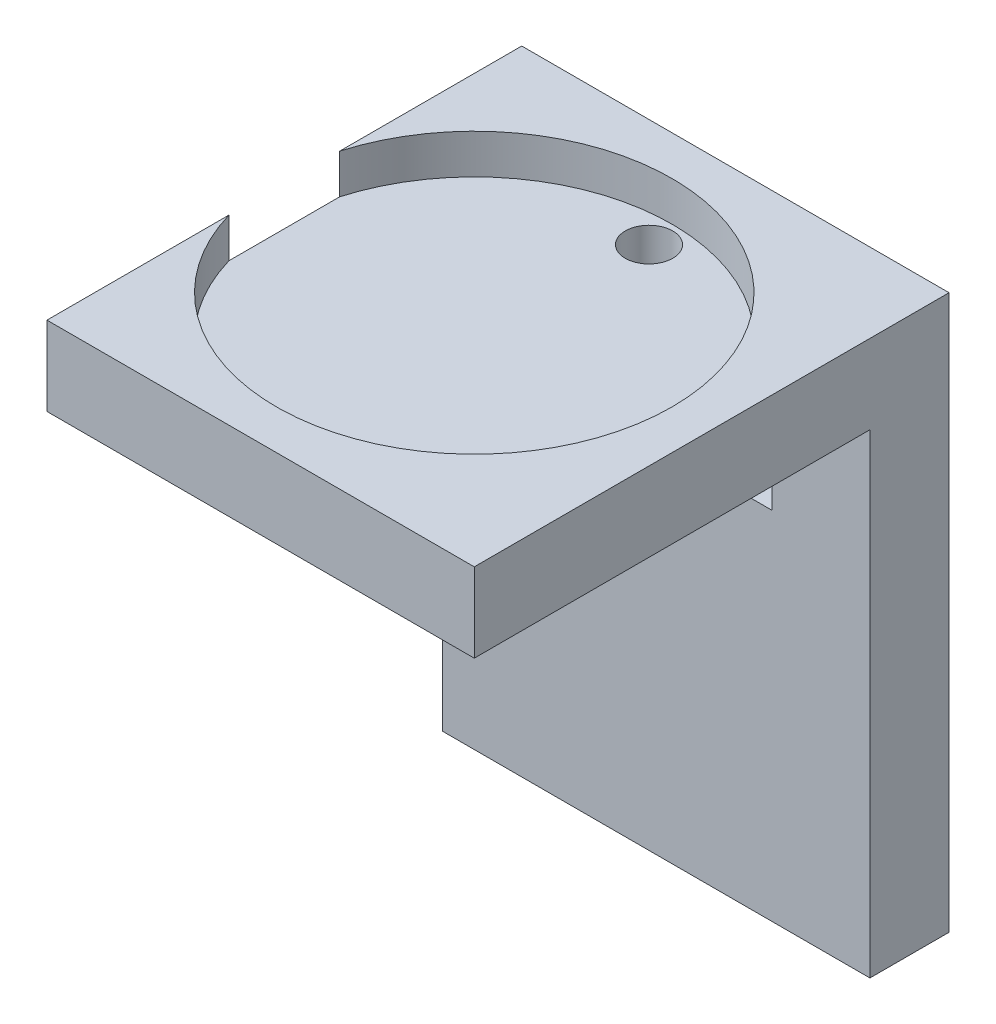
from build123d import *

# Parameters (mm, degrees)
SKETCH1_W                      = 670
SKETCH1_H                      = 120
BOSS_EXTRUDE1_DEPTH            = 530
SKETCH2_W                      = 100
SKETCH2_H                      = 200
SKETCH2_W_2                    = 650
SKETCH2_H_2                    = 250
CUT_EXTRUDE1_DEPTH             = 100
SKETCH3_R                      = 50
CUT_EXTRUDE2_DEPTH             = 260
F_12_0_12_DIAMETER_HOLE2_D     = 12
F_12_0_12_DIAMETER_HOLE2_DEPTH = 30
F_12_0_12_DIAMETER_HOLE2_TIP   = 3.605163714
SKETCH8_W                      = 650
SKETCH8_H                      = 50
BOSS_EXTRUDE2_DEPTH            = 5
SKETCH9_W                      = 10
SKETCH9_H                      = 250
CUT_EXTRUDE3_DEPTH             = 717
CUT_EXTRUDE4_DEPTH             = 5
SKETCH11_W                     = 10
SKETCH11_H                     = 100
BOSS_EXTRUDE3_DEPTH            = 78
BOSS_EXTRUDE3_2_DEPTH          = 78
BOSS_EXTRUDE3_3_DEPTH          = 78
SKETCH12_W                     = 20
SKETCH12_H                     = 30
CUT_EXTRUDE5_DEPTH             = 80
SKETCH15_W                     = 30
SKETCH15_H                     = 23.536156656
SKETCH15_H_2                   = 28.986603691
CUT_EXTRUDE7_DEPTH             = 35
SHELL1_T                       = -3
SKETCH16_W                     = 14
SKETCH16_H                     = 14
CUT_EXTRUDE8_DEPTH             = 35
SKETCH17_W                     = 5.729882812
SKETCH17_H                     = 17.428393554
SKETCH17_W_2                   = 13.369726562
SKETCH17_H_2                   = 3.342431641
BOSS_EXTRUDE4_DEPTH            = 5
CUT_EXTRUDE10_DEPTH            = 863.670273187
CUT_EXTRUDE10_DEPTH_BACK       = 863.670273187
SKETCH18_W                     = 670
SKETCH18_H                     = 250
CUT_EXTRUDE12_DEPTH            = 734.007503372
CUT_EXTRUDE12_DEPTH_BACK       = 734.007503372
SKETCH19_W                     = 440
SKETCH19_H                     = 280
SKETCH20_W                     = 210.918945895
SKETCH20_H                     = 296.400973443
CUT_EXTRUDE14_DEPTH            = 156
CUT_EXTRUDE15_DEPTH            = 376.898922584
CUT_EXTRUDE15_DEPTH_BACK       = 376.898922584
SKETCH21_W                     = 108
SKETCH21_H                     = 140


with BuildPart() as part:
    # Sketch1 → Boss-Extrude1 (new body)
    with BuildSketch(Plane(origin=(0, 0, 0), x_dir=(1, 0, 0), z_dir=(0, 1, 0))):
        with Locations((335, 60)):
            Rectangle(SKETCH1_W, SKETCH1_H)
    extrude(amount=BOSS_EXTRUDE1_DEPTH)

    # Sketch2 → Cut-Extrude1 (cut)
    with BuildSketch(Plane.XY):
        with Locations((60, 380)):
            Rectangle(SKETCH2_W, SKETCH2_H)
        with Locations((170, 380)):
            Rectangle(SKETCH2_W, SKETCH2_H)
        with Locations((280, 380)):
            Rectangle(SKETCH2_W, SKETCH2_H)
        with Locations((390, 380)):
            Rectangle(SKETCH2_W, SKETCH2_H)
        with Locations((500, 380)):
            Rectangle(SKETCH2_W, SKETCH2_H)
        with Locations((610, 380)):
            Rectangle(SKETCH2_W, SKETCH2_H)
        with Locations((335, 135)):
            Rectangle(SKETCH2_W_2, SKETCH2_H_2)
    extrude(amount=-CUT_EXTRUDE1_DEPTH, mode=Mode.SUBTRACT)

    # Sketch3 → Cut-Extrude2 (cut)
    with BuildSketch(Plane(origin=(0, 530, 0), x_dir=(1, 0, 0), z_dir=(0, 1, 0))):
        with Locations(Location((60, 60, 0), (0, 0, 270))):
            Circle(SKETCH3_R)
        with Locations(Location((170, 60, 0), (0, 0, 270))):
            Circle(SKETCH3_R)
        with Locations(Location((280, 60, 0), (0, 0, 270))):
            Circle(SKETCH3_R)
        with Locations(Location((390, 60, 0), (0, 0, 270))):
            Circle(SKETCH3_R)
        with Locations(Location((500, 60, 0), (0, 0, 270))):
            Circle(SKETCH3_R)
        with Locations(Location((610, 60, 0), (0, 0, 270))):
            Circle(SKETCH3_R)
    extrude(amount=-CUT_EXTRUDE2_DEPTH, mode=Mode.SUBTRACT)

    # Ø12.0 (12) Diameter Hole2
    with Locations(Plane(origin=(59.704642413, 270, -102.411697903), x_dir=(0, 0, 1), z_dir=(0, 1, 0))):
        with Locations((0, 0), (-0.195888006, 111.8520513), (0.014838595, 221.167624818), (-0.341843303, 331.364008353), (0.657723149, 441.008646429), (1.288998006, 549.811854685)):
            Hole(F_12_0_12_DIAMETER_HOLE2_D / 2, depth=F_12_0_12_DIAMETER_HOLE2_DEPTH)
            with Locations((0, 0, -(F_12_0_12_DIAMETER_HOLE2_DEPTH + F_12_0_12_DIAMETER_HOLE2_TIP / 2))):  # 118° drill point
                Cone(0, F_12_0_12_DIAMETER_HOLE2_D / 2, F_12_0_12_DIAMETER_HOLE2_TIP, mode=Mode.SUBTRACT)

    # Sketch8 → Boss-Extrude2 (add)
    with BuildSketch(Plane.XY):
        with Locations((335, 305)):
            Rectangle(SKETCH8_W, SKETCH8_H)
    extrude(amount=-BOSS_EXTRUDE2_DEPTH)

    # Sketch9 → Cut-Extrude3 (cut)
    with BuildSketch(Plane(origin=(670, 0, 0), x_dir=(0, 0, -1), z_dir=(1, 0, 0))):
        with Locations((15, 135)):
            Rectangle(SKETCH9_W, SKETCH9_H)
    extrude(amount=-CUT_EXTRUDE3_DEPTH, mode=Mode.SUBTRACT)

    # Sketch10 → Cut-Extrude4 (cut)
    with BuildSketch(Plane(origin=(0, 10, 0), x_dir=(1, 0, 0), z_dir=(0, 1, 0))):
        Polygon((365, 61.943560596), (350, 87.924322709), (320, 87.924322709), (305, 61.943560596), (320, 35.962798482), (350, 35.962798482), align=None)
    extrude(amount=-CUT_EXTRUDE4_DEPTH, mode=Mode.SUBTRACT)

    # Sketch12 → Cut-Extrude5 (cut)
    with BuildSketch(Plane.XY.offset(-100)):
        with Locations((85.198613037, 245)):
            Rectangle(SKETCH12_W, SKETCH12_H)
        with Locations((195.198613037, 245)):
            Rectangle(SKETCH12_W, SKETCH12_H)
        with Locations((305.198613037, 245)):
            Rectangle(SKETCH12_W, SKETCH12_H)
        with Locations((415.198613037, 245)):
            Rectangle(SKETCH12_W, SKETCH12_H)
        with Locations((525.198613037, 245)):
            Rectangle(SKETCH12_W, SKETCH12_H)
        with Locations((635.198613037, 245)):
            Rectangle(SKETCH12_W, SKETCH12_H)
    extrude(amount=-CUT_EXTRUDE5_DEPTH, mode=Mode.SUBTRACT)

    # Sketch17 → Boss-Extrude4 (add)
    # profile 1 of 9: a face of its own
    with BuildSketch(Plane.XY):
        with BuildLine():
            Line((527.508830928, 289.835452458), (527.508830928, 307.263846012))
            Line((527.508830928, 307.263846012), (534.861434459, 307.263846012))
            add(Edge.make_bspline(
                [(534.861434459, 307.263846012), (535.181337774, 307.258256848), (535.803061116, 307.24739446), (536.703508491, 307.139069344), (537.544992916, 306.975202489), (538.325061607, 306.737496792), (539.040841948, 306.426020155), (539.698044515, 306.051894954), (540.290333057, 305.605079277), (540.822348212, 305.090232636), (541.284521701, 304.502523111), (541.692171296, 303.852565801), (542.030284458, 303.129762281), (542.309377095, 302.341316546), (542.5243908, 301.484161689), (542.679660381, 300.560045938), (542.773357357, 299.567500804), (542.783368073, 298.883107022), (542.788518428, 298.530997273)],
                knots=[0, 0, 0, 0, 1.135059408, 2.20595691, 3.214417064, 4.174978569, 5.094187092, 5.980001006, 6.853065862, 7.720814779, 8.600404634, 9.50058483, 10.438414914, 11.426825708, 12.465239141, 13.571113463, 14.750376389, 16, 16, 16, 16], degree=3))
            add(Edge.make_bspline(
                [(542.788518428, 298.530997273), (542.781740751, 298.180151665), (542.768592871, 297.499553336), (542.676885992, 296.511518461), (542.516733301, 295.591080531), (542.296748778, 294.736450427), (542.003051046, 293.953120444), (541.654236167, 293.233205539), (541.233025793, 292.585291498), (540.753136904, 292.000029304), (540.204772188, 291.484681411), (539.587651059, 291.044279297), (538.910779309, 290.668464036), (538.169670382, 290.361903209), (537.364073889, 290.124869172), (536.495133477, 289.954199984), (535.562644449, 289.853487388), (534.920131033, 289.841584621), (534.58911581, 289.835452458)],
                knots=[0, 0, 0, 0, 1.228418252, 2.382983832, 3.470276728, 4.496757894, 5.468023682, 6.394867725, 7.292157164, 8.167372942, 9.039072913, 9.918728341, 10.815246345, 11.744296628, 12.720973084, 13.750736166, 14.841206188, 16, 16, 16, 16], degree=3))
            Line((534.58911581, 289.835452458), (527.508830928, 289.835452458))
        make_face()
        with BuildLine():
            Line((533.238713741, 291.745413395), (534.048208904, 291.745413395))
            add(Edge.make_bspline(
                [(534.048208904, 291.745413395), (534.172894012, 291.749291978), (534.413033311, 291.756761998), (534.758676231, 291.825976613), (535.075745017, 291.938271137), (535.365749176, 292.094802589), (535.623404602, 292.300450923), (535.848862806, 292.551404902), (536.04776914, 292.844737637), (536.217685755, 293.190205032), (536.364284647, 293.596533622), (536.481764702, 294.076367921), (536.592118304, 294.630928744), (536.673672739, 295.265507643), (536.740044562, 295.978448886), (536.788346679, 296.768428292), (536.812018936, 297.636801208), (536.817188964, 298.241258393), (536.819890499, 298.55711002)],
                knots=[0, 0, 0, 0, 0.728710832, 1.403472396, 2.052289494, 2.690292559, 3.321919393, 3.970736491, 4.656696891, 5.388631723, 6.217040872, 7.17856157, 8.275589967, 9.523440737, 10.918935818, 12.463926104, 14.152268318, 16, 16, 16, 16], degree=3))
            add(Edge.make_bspline(
                [(536.819890499, 298.55711002), (536.8171426, 298.871715251), (536.811863063, 299.476166083), (536.7886758, 300.343334385), (536.739579947, 301.133216935), (536.674703848, 301.843934916), (536.589660404, 302.476324031), (536.488366458, 303.031681737), (536.362441588, 303.507627045), (536.222158727, 303.914921549), (536.050140993, 304.256514038), (535.858357073, 304.554097881), (535.62547107, 304.79746827), (535.36991257, 305.004888479), (535.079348843, 305.160875844), (534.761320266, 305.273944358), (534.414185903, 305.34216807), (534.172870641, 305.349893944), (534.048208904, 305.353885075)],
                knots=[0, 0, 0, 0, 1.842836665, 3.540640921, 5.080358154, 6.47765669, 7.719902824, 8.816971715, 9.781579111, 10.601733135, 11.334613876, 12.017393917, 12.666641099, 13.29908421, 13.937911793, 14.587567384, 15.270347425, 16, 16, 16, 16], degree=3))
            Line((534.048208904, 305.353885075), (533.238713741, 305.353885075))
            Line((533.238713741, 305.353885075), (533.238713741, 291.745413395))
        make_face(mode=Mode.SUBTRACT)
    # profile 2 of 9: a face of its own
    with BuildSketch(Plane.XY):
        with Locations((547.563420772, 298.549649235)):
            Rectangle(SKETCH17_W, SKETCH17_H)
    # profile 3 of 9: a face of its own
    with BuildSketch(Plane.XY):
        Polygon((564.514324092, 307.263846012), (564.514324092, 305.115139958), (558.545696163, 305.115139958), (558.545696163, 299.862747379), (563.559343624, 299.862747379), (563.559343624, 297.714041325), (558.545696163, 297.714041325), (558.545696163, 289.835452458), (552.81581335, 289.835452458), (552.81581335, 307.263846012), align=None)
    # profile 4 of 9: a face of its own
    with BuildSketch(Plane.XY):
        Polygon((577.645305538, 307.263846012), (577.645305538, 305.115139958), (571.676677608, 305.115139958), (571.676677608, 299.862747379), (576.690325069, 299.862747379), (576.690325069, 297.714041325), (571.676677608, 297.714041325), (571.676677608, 289.835452458), (565.946794795, 289.835452458), (565.946794795, 307.263846012), align=None)
    # profile 5 of 9: a face of its own
    with BuildSketch(Plane.XY):
        with Locations((584.330168819, 287.448001286)):
            Rectangle(SKETCH17_W_2, SKETCH17_H_2)
    # profile 6 of 9: a face of its own
    with BuildSketch(Plane.XY):
        with BuildLine():
            Line((605.578484249, 307.263846012), (605.578484249, 295.602639195))
            add(Edge.make_bspline(
                [(605.578484249, 295.602639195), (605.574209777, 295.35989389), (605.565919345, 294.889083964), (605.480877158, 294.20653885), (605.349958188, 293.569747554), (605.15926554, 292.978838165), (604.911867049, 292.436847071), (604.616163877, 291.936663973), (604.260702644, 291.487723021), (603.847299908, 291.08966617), (603.386881991, 290.731670113), (602.867295001, 290.425440037), (602.293741958, 290.168488385), (601.66690529, 289.960990771), (600.988052682, 289.797299786), (600.254912883, 289.679078851), (599.467035781, 289.60781007), (598.923618241, 289.60048219), (598.643684673, 289.59670734)],
                knots=[0, 0, 0, 0, 1.108173197, 2.149326602, 3.136215123, 4.073726706, 4.978516626, 5.852185058, 6.72141202, 7.584905625, 8.467554395, 9.379216169, 10.332422268, 11.332766067, 12.390653242, 13.518530507, 14.721707419, 16, 16, 16, 16], degree=3))
            add(Edge.make_bspline(
                [(598.643684673, 289.59670734), (598.373688491, 289.600411437), (597.851346557, 289.607577482), (597.093280473, 289.679448684), (596.387523889, 289.797736542), (595.733050135, 289.960122315), (595.130189942, 290.169220301), (594.579048171, 290.42623041), (594.078350789, 290.732835498), (593.633858028, 291.090104794), (593.234289459, 291.486851767), (592.899913678, 291.940746827), (592.609043638, 292.435866034), (592.375223767, 292.980322997), (592.191754821, 293.570441519), (592.063541006, 294.20666921), (591.983676196, 294.889343196), (591.974661767, 295.359932437), (591.970012569, 295.602639195)],
                knots=[0, 0, 0, 0, 1.258901956, 2.435505865, 3.547148904, 4.59359074, 5.576649289, 6.5183682, 7.424469602, 8.307507093, 9.172751023, 10.042627298, 10.928839176, 11.845659241, 12.799442865, 13.80597989, 14.868432463, 16, 16, 16, 16], degree=3))
            Line((591.970012569, 295.602639195), (591.970012569, 307.263846012))
            Line((591.970012569, 307.263846012), (597.699895381, 307.263846012))
            Line((597.699895381, 307.263846012), (597.699895381, 295.457153889))
            add(Edge.make_bspline(
                [(597.699895381, 295.457153889), (597.700816195, 295.287996189), (597.702584578, 294.963135903), (597.729908723, 294.499051493), (597.768241004, 294.079064133), (597.828226169, 293.705517832), (597.90066041, 293.377063412), (597.989882091, 293.09281535), (598.094998068, 292.852496478), (598.225239063, 292.654232043), (598.380826623, 292.495135011), (598.55368342, 292.353231761), (598.757556996, 292.238543846), (598.987648905, 292.146224908), (599.243380948, 292.070549638), (599.526120553, 292.020376099), (599.83553351, 291.990763905), (600.049971942, 291.986424568), (600.161954402, 291.984158512)],
                knots=[0, 0, 0, 0, 1.622370975, 3.115695595, 4.458049099, 5.666011203, 6.742434742, 7.681714947, 8.519814998, 9.250928664, 9.942747364, 10.646898194, 11.389596108, 12.175933929, 13.021386247, 13.943159715, 14.925891993, 16, 16, 16, 16], degree=3))
            add(Edge.make_bspline(
                [(600.161954402, 291.984158512), (600.283927219, 291.987190593), (600.521124756, 291.993087005), (600.86597014, 292.03390861), (601.187714881, 292.103380086), (601.484890424, 292.205377303), (601.758665297, 292.332852529), (602.012761516, 292.484567923), (602.236391413, 292.674631152), (602.439076761, 292.888441291), (602.620738276, 293.128529789), (602.771757722, 293.399928575), (602.905501548, 293.697121508), (603.005823683, 294.025060118), (603.089837826, 294.379999499), (603.146989706, 294.763086929), (603.186210275, 295.174074524), (603.189394751, 295.457053988), (603.191033077, 295.602639195)],
                knots=[0, 0, 0, 0, 1.083870311, 2.107775948, 3.08105344, 4.003637981, 4.893545291, 5.761570557, 6.624657808, 7.49233129, 8.376387281, 9.291996285, 10.246843261, 11.267344133, 12.334180325, 13.486053461, 14.706643157, 16, 16, 16, 16], degree=3))
            Line((603.191033077, 295.602639195), (603.191033077, 307.263846012))
            Line((603.191033077, 307.263846012), (605.578484249, 307.263846012))
        make_face()
    # profile 7 of 9: a face of its own
    with BuildSketch(Plane.XY):
        with BuildLine():
            Line((619.731593227, 302.015183827), (616.739818477, 301.526502415))
            add(Edge.make_bspline(
                [(616.739818477, 301.526502415), (616.748849224, 301.670726223), (616.765660669, 301.939210177), (616.78429066, 302.312269209), (616.796668381, 302.625642376), (616.798628236, 302.814722915), (616.799504756, 302.899286839)],
                knots=[0, 0, 0, 0, 1.261802504, 2.348944521, 3.261585937, 4, 4, 4, 4], degree=3))
            add(Edge.make_bspline(
                [(616.799504756, 302.899286839), (616.798306068, 303.007660677), (616.795968139, 303.219033721), (616.750451916, 303.523894877), (616.694806916, 303.811547356), (616.604352699, 304.076787391), (616.488181329, 304.320314265), (616.348943917, 304.543955606), (616.184187178, 304.745078709), (615.995833421, 304.928129987), (615.778009957, 305.083200131), (615.536269472, 305.218702836), (615.269765326, 305.333844758), (614.978065514, 305.431346685), (614.660683072, 305.504624438), (614.319025281, 305.556776695), (613.952471696, 305.585673441), (613.699597795, 305.590260771), (613.568984889, 305.592630192)],
                knots=[0, 0, 0, 0, 1.079280541, 2.105035848, 3.067950317, 3.99715044, 4.889989748, 5.753421302, 6.617030865, 7.476358039, 8.364190572, 9.274590025, 10.235106994, 11.254473582, 12.337095886, 13.478601727, 14.697662529, 16, 16, 16, 16], degree=3))
            add(Edge.make_bspline(
                [(613.568984889, 305.592630192), (613.391954632, 305.58912286), (613.059112606, 305.582528579), (612.595688488, 305.495339748), (612.198743126, 305.361419257), (611.87165349, 305.163811893), (611.613188167, 304.909795747), (611.433841092, 304.593316589), (611.323009072, 304.224665915), (611.313400221, 303.959558324), (611.308367061, 303.820693775)],
                knots=[0, 0, 0, 0, 1.294917039, 2.43462794, 3.440028966, 4.347597256, 5.210608309, 6.06356377, 6.985685997, 8, 8, 8, 8], degree=3))
            add(Edge.make_bspline(
                [(611.308367061, 303.820693775), (611.317562032, 303.705133219), (611.336106628, 303.472068433), (611.47315858, 303.132808312), (611.695999602, 302.811560885), (612.009295906, 302.510664216), (612.404107796, 302.221967273), (612.884407504, 301.948533431), (613.450813789, 301.688189695), (613.862519081, 301.536023727), (614.080048656, 301.455624958)],
                knots=[0, 0, 0, 0, 0.716839541, 1.445735977, 2.240793036, 3.131329288, 4.131129903, 5.273471266, 6.559404876, 8, 8, 8, 8], degree=3))
            add(Edge.make_bspline(
                [(614.080048656, 301.455624958), (614.335934702, 301.364918412), (614.834564244, 301.188164095), (615.547657928, 300.88707802), (616.213068388, 300.5749594), (616.829579094, 300.246613346), (617.397833174, 299.90520698), (617.914851624, 299.544556457), (618.386199073, 299.173962102), (618.807001026, 298.783874588), (619.177995113, 298.378100064), (619.4958685, 297.952745357), (619.771807525, 297.51723103), (619.991113975, 297.061458502), (620.169645242, 296.594624218), (620.292698657, 296.11024444), (620.364288243, 295.609761088), (620.37516617, 295.270864226), (620.380681514, 295.099036213)],
                knots=[0, 0, 0, 0, 1.359488612, 2.649152603, 3.874964776, 5.039588756, 6.146130126, 7.193090393, 8.194917302, 9.146793662, 10.063845301, 10.944476293, 11.803344532, 12.641736646, 13.473440096, 14.302714936, 15.139439897, 16, 16, 16, 16], degree=3))
            add(Edge.make_bspline(
                [(620.380681514, 295.099036213), (620.374476075, 294.902306495), (620.362285176, 294.515820995), (620.280160209, 293.948630617), (620.138011896, 293.409496554), (619.938489338, 292.895972278), (619.681049879, 292.411946655), (619.366518754, 291.954381076), (618.996510229, 291.525099427), (618.5710008, 291.128381035), (618.102222518, 290.765302239), (617.587803957, 290.450854345), (617.034458515, 290.187092261), (616.444107988, 289.968993032), (615.81453624, 289.801373099), (615.145337453, 289.685291013), (614.438790193, 289.606619894), (613.954683001, 289.600062276), (613.70700941, 289.59670734)],
                knots=[0, 0, 0, 0, 0.972121714, 1.909782367, 2.824924061, 3.721832975, 4.62620438, 5.527836938, 6.46026819, 7.421000932, 8.398101015, 9.385579713, 10.394244048, 11.422703992, 12.491421888, 13.608778581, 14.776629625, 16, 16, 16, 16], degree=3))
            add(Edge.make_bspline(
                [(613.70700941, 289.59670734), (613.445745367, 289.599650312), (612.939893069, 289.605348413), (612.207608113, 289.66709241), (611.525297432, 289.760984454), (610.893395078, 289.899706116), (610.309273131, 290.072394336), (609.776099392, 290.288320955), (609.295310255, 290.547303481), (608.863217672, 290.843007892), (608.478306623, 291.175775461), (608.148120946, 291.551766865), (607.86942369, 291.967163224), (607.639947144, 292.421521488), (607.466477665, 292.917583541), (607.339164663, 293.449829748), (607.264537999, 294.021332449), (607.254747521, 294.414908557), (607.249700069, 294.617815586)],
                knots=[0, 0, 0, 0, 1.342201143, 2.598733168, 3.773451092, 4.878874364, 5.91991243, 6.900006476, 7.829142054, 8.72062616, 9.585588575, 10.436728592, 11.283829734, 12.149664931, 13.044964919, 13.977937424, 14.957531465, 16, 16, 16, 16], degree=3))
            add(Edge.make_bspline(
                [(607.249700069, 294.617815586), (607.250803815, 294.692425759), (607.253213998, 294.855347393), (607.260452266, 295.122772538), (607.275636683, 295.433682216), (607.29037174, 295.656130545), (607.298195171, 295.774237248)],
                knots=[0, 0, 0, 0, 0.773500207, 1.689044709, 2.77302154, 4, 4, 4, 4], degree=3))
            Line((607.298195171, 295.774237248), (610.36457777, 296.337526509))
            add(Edge.make_bspline(
                [(610.36457777, 296.337526509), (610.326952988, 296.136337493), (610.255606535, 295.754830366), (610.178678473, 295.21219969), (610.124206629, 294.733311493), (610.11767002, 294.435147371), (610.114641475, 294.297001835)],
                knots=[0, 0, 0, 0, 1.192988372, 2.262218769, 3.194850416, 4, 4, 4, 4], degree=3))
            add(Edge.make_bspline(
                [(610.114641475, 294.297001835), (610.116191817, 294.183708768), (610.119182568, 293.965156219), (610.159053378, 293.648552813), (610.215988606, 293.352999663), (610.302906772, 293.079707227), (610.411206928, 292.826307836), (610.544682453, 292.59538211), (610.704385489, 292.386485019), (610.887496571, 292.200099922), (611.094689168, 292.033628705), (611.327456494, 291.892756696), (611.58347653, 291.771733922), (611.864681562, 291.677479524), (612.167961721, 291.596080628), (612.497219749, 291.548235723), (612.849461228, 291.512043782), (613.092629543, 291.508500084), (613.218327999, 291.506668278)],
                knots=[0, 0, 0, 0, 1.135776692, 2.191015738, 3.19649269, 4.151244236, 5.061952528, 5.956281389, 6.819534407, 7.692823504, 8.571441916, 9.478554956, 10.416037156, 11.406231466, 12.450054172, 13.561596327, 14.739541482, 16, 16, 16, 16], degree=3))
            add(Edge.make_bspline(
                [(613.218327999, 291.506668278), (613.423996012, 291.510791273), (613.810619321, 291.518541853), (614.349272542, 291.616708407), (614.810575885, 291.768742445), (615.189785268, 291.991387532), (615.490778961, 292.278756613), (615.698005174, 292.637320004), (615.824813318, 293.05638326), (615.837728413, 293.355975238), (615.844524288, 293.513619419)],
                knots=[0, 0, 0, 0, 1.308765556, 2.460272085, 3.475015317, 4.388076298, 5.239673503, 6.095681635, 6.997954785, 8, 8, 8, 8], degree=3))
            add(Edge.make_bspline(
                [(615.844524288, 293.513619419), (615.833808824, 293.638242951), (615.811807312, 293.894126055), (615.644884004, 294.264515838), (615.382382362, 294.620631473), (615.016807277, 294.962984909), (614.551376589, 295.293471235), (613.986957743, 295.616730224), (613.322148235, 295.933112033), (612.83677959, 296.119639164), (612.580430889, 296.21815395)],
                knots=[0, 0, 0, 0, 0.667930748, 1.371427933, 2.146459016, 3.034714139, 4.04893387, 5.207327294, 6.525042705, 8, 8, 8, 8], degree=3))
            add(Edge.make_bspline(
                [(612.580430889, 296.21815395), (612.374354345, 296.29679374), (611.970646869, 296.450850434), (611.394079385, 296.713586304), (610.853066711, 296.987016804), (610.357486361, 297.288235735), (609.896382561, 297.599610528), (609.477036946, 297.932256792), (609.09841673, 298.284556341), (608.758710772, 298.653375077), (608.457302107, 299.038989264), (608.199448649, 299.444659231), (607.977533299, 299.866789834), (607.798609588, 300.308107488), (607.65975715, 300.767821241), (607.559616231, 301.244439392), (607.497905054, 301.739995674), (607.491630423, 302.075933546), (607.488445186, 302.246468159)],
                knots=[0, 0, 0, 0, 1.249558333, 2.447906163, 3.58867143, 4.682264114, 5.731748367, 6.739728761, 7.711906036, 8.659384707, 9.578321416, 10.481344598, 11.379544271, 12.277135726, 13.175418307, 14.097160112, 15.034047388, 16, 16, 16, 16], degree=3))
            add(Edge.make_bspline(
                [(607.488445186, 302.246468159), (607.49282555, 302.439538736), (607.501402184, 302.817565692), (607.587451154, 303.36980586), (607.719291893, 303.894921371), (607.910558542, 304.389343064), (608.156192894, 304.852853762), (608.453187669, 305.288766511), (608.804241719, 305.697593471), (609.213503754, 306.066686531), (609.657214714, 306.407618241), (610.14376173, 306.697651931), (610.658716537, 306.950861947), (611.210636666, 307.148827868), (611.791820619, 307.313252612), (612.408080529, 307.421140415), (613.056315391, 307.490701612), (613.499160755, 307.498567824), (613.725661373, 307.502591129)],
                knots=[0, 0, 0, 0, 1.01033566, 1.978209831, 2.919499157, 3.840961976, 4.746855014, 5.660740114, 6.597989116, 7.56120833, 8.541877795, 9.523498025, 10.522416858, 11.542172371, 12.589598349, 13.681636521, 14.814234488, 16, 16, 16, 16], degree=3))
            add(Edge.make_bspline(
                [(613.725661373, 307.502591129), (613.968269855, 307.498219033), (614.438190994, 307.489750488), (615.120391152, 307.426787419), (615.755073228, 307.319142339), (616.345153155, 307.171557286), (616.887304575, 306.977590666), (617.384933999, 306.742393454), (617.834452216, 306.46201507), (618.236961315, 306.139451502), (618.593086714, 305.773322851), (618.897467704, 305.361641069), (619.158701245, 304.909408454), (619.366684143, 304.412232174), (619.529870326, 303.873247147), (619.649133834, 303.29158184), (619.720420497, 302.667301443), (619.72779778, 302.236712324), (619.731593227, 302.015183827)],
                knots=[0, 0, 0, 0, 1.248314423, 2.417925914, 3.521398822, 4.558068205, 5.543720209, 6.479599284, 7.385061127, 8.263440163, 9.127722873, 10.00561236, 10.891325273, 11.808802823, 12.772251995, 13.784947978, 14.860405143, 16, 16, 16, 16], degree=3))
        make_face()
    # profile 8 of 9: a face of its own
    with BuildSketch(Plane.XY):
        Polygon((633.989153194, 307.263846012), (633.989153194, 305.115139958), (628.020525264, 305.115139958), (628.020525264, 300.340237614), (633.034172725, 300.340237614), (633.034172725, 298.191531559), (628.020525264, 298.191531559), (628.020525264, 291.984158512), (634.944133663, 291.984158512), (634.944133663, 289.835452458), (622.290642452, 289.835452458), (622.290642452, 307.263846012), align=None)
    # profile 9 of 9: a face of its own
    with BuildSketch(Plane.XY):
        with BuildLine():
            Line((636.376604366, 289.835452458), (636.376604366, 307.263846012))
            Line((636.376604366, 307.263846012), (643.990335369, 307.263846012))
            add(Edge.make_bspline(
                [(643.990335369, 307.263846012), (644.237946498, 307.261150834), (644.721600887, 307.25588639), (645.426490561, 307.189203683), (646.094808274, 307.090496236), (646.724915796, 306.949857504), (647.317873659, 306.767252686), (647.871119087, 306.542146), (648.390701058, 306.282329135), (648.864494846, 305.976472528), (649.295093616, 305.642889252), (649.669668547, 305.279483604), (649.990389523, 304.894749072), (650.250664962, 304.483256345), (650.454275633, 304.048690948), (650.59581384, 303.587791605), (650.684089268, 303.104102537), (650.695510601, 302.772834174), (650.701311397, 302.604585835)],
                knots=[0, 0, 0, 0, 1.303269877, 2.545653735, 3.724355284, 4.8584284, 5.941462088, 6.987020715, 8.000098032, 8.995332524, 9.951400474, 10.863507538, 11.737823931, 12.582415999, 13.420128714, 14.25671499, 15.114600608, 16, 16, 16, 16], degree=3))
            add(Edge.make_bspline(
                [(650.701311397, 302.604585835), (650.698282873, 302.472674957), (650.692382063, 302.215658276), (650.651041486, 301.838684287), (650.580643818, 301.480313933), (650.481036683, 301.139915259), (650.347814833, 300.820175594), (650.191279492, 300.517863507), (650.009772227, 300.230553342), (649.788675198, 299.970497982), (649.548268341, 299.722842359), (649.274558803, 299.497116911), (648.974487035, 299.288655528), (648.642526299, 299.104010513), (648.287619671, 298.928055749), (647.899038177, 298.784921972), (647.486819978, 298.644749395), (647.19793098, 298.577036306), (647.049257183, 298.54218845)],
                knots=[0, 0, 0, 0, 1.057156483, 2.059775939, 3.035078039, 3.981068617, 4.897189472, 5.80650904, 6.70770952, 7.613691521, 8.536886357, 9.470937334, 10.45233069, 11.461024139, 12.51295332, 13.623444893, 14.776929983, 16, 16, 16, 16], degree=3))
            add(Edge.make_bspline(
                [(647.049257183, 298.54218845), (647.19164695, 298.499279419), (647.467865022, 298.416041346), (647.856360945, 298.265600017), (648.211652989, 298.111536308), (648.524185739, 297.936781388), (648.807636894, 297.762122504), (649.047122259, 297.564301324), (649.255235567, 297.361673563), (649.425188343, 297.135464734), (649.570253643, 296.882344437), (649.694827156, 296.586596707), (649.815179167, 296.247423665), (649.917667348, 295.859098311), (650.004750555, 295.423699276), (650.088222437, 294.944027189), (650.153853601, 294.416024546), (650.187587341, 294.048412906), (650.2051692, 293.856815525)],
                knots=[0, 0, 0, 0, 1.149282524, 2.229462177, 3.219229774, 4.139917433, 4.995948464, 5.788695735, 6.536448429, 7.236319808, 7.968460079, 8.78645307, 9.713791991, 10.749194692, 11.887975363, 13.146018663, 14.512518948, 16, 16, 16, 16], degree=3))
            add(Edge.make_bspline(
                [(650.2051692, 293.856815525), (650.225980287, 293.627849833), (650.265975604, 293.187817268), (650.348933081, 292.554613589), (650.44386163, 291.974357025), (650.555874504, 291.44528724), (650.681301216, 290.967898855), (650.821280597, 290.540469593), (650.979920039, 290.165788217), (651.10484481, 289.941461656), (651.163880062, 289.835452458)],
                knots=[0, 0, 0, 0, 1.324580516, 2.545615266, 3.678710841, 4.711533017, 5.660403917, 6.521349952, 7.301239649, 8, 8, 8, 8], degree=3))
            Line((651.163880062, 289.835452458), (645.213904094, 289.835452458))
            add(Edge.make_bspline(
                [(645.213904094, 289.835452458), (645.12229736, 290.069847279), (644.935171241, 290.548648246), (644.7595281, 291.319414791), (644.64846922, 292.142514735), (644.635117598, 292.70994511), (644.628232479, 293.002555653)],
                knots=[0, 0, 0, 0, 0.930410518, 1.900560147, 2.917368081, 4, 4, 4, 4], degree=3))
            Line((644.628232479, 293.002555653), (644.605850124, 294.002300831))
            Line((644.605850124, 294.002300831), (644.579737377, 295.266903874))
            add(Edge.make_bspline(
                [(644.579737377, 295.266903874), (644.573694669, 295.477395004), (644.562357007, 295.872330118), (644.469348432, 296.426164013), (644.30178735, 296.894645884), (644.073222546, 297.287223005), (643.766741442, 297.590613479), (643.39104803, 297.804152917), (642.950456912, 297.93396284), (642.634664848, 297.946292392), (642.468335247, 297.952786442)],
                knots=[0, 0, 0, 0, 1.295300309, 2.430314163, 3.439929415, 4.342995669, 5.203512789, 6.060756153, 6.978588463, 8, 8, 8, 8], degree=3))
            Line((642.468335247, 297.952786442), (642.106487178, 297.952786442))
            Line((642.106487178, 297.952786442), (642.106487178, 289.835452458))
            Line((642.106487178, 289.835452458), (636.376604366, 289.835452458))
        make_face()
        with BuildLine():
            Line((642.106487178, 299.862747379), (642.617550945, 299.862747379))
            add(Edge.make_bspline(
                [(642.617550945, 299.862747379), (642.722054451, 299.865172716), (642.925280724, 299.869889229), (643.220054897, 299.898289891), (643.494111408, 299.951809873), (643.749840966, 300.021017819), (643.984372137, 300.114851792), (644.200147241, 300.225818296), (644.391160406, 300.362685327), (644.565327067, 300.516342321), (644.718148635, 300.691986294), (644.850351299, 300.889034217), (644.961199162, 301.106225057), (645.056078491, 301.342818683), (645.125883912, 301.600830857), (645.173262731, 301.879472914), (645.203404658, 302.177423605), (645.207875435, 302.383174491), (645.210173702, 302.488943669)],
                knots=[0, 0, 0, 0, 1.184986479, 2.304423995, 3.352332712, 4.347714965, 5.303263624, 6.211353909, 7.091434645, 7.960150225, 8.839440182, 9.723126897, 10.64371617, 11.599264829, 12.608232147, 13.667459739, 14.800924404, 16, 16, 16, 16], degree=3))
            add(Edge.make_bspline(
                [(645.210173702, 302.488943669), (645.207875435, 302.594712847), (645.203404658, 302.800463732), (645.173262731, 303.098414423), (645.125883912, 303.37705648), (645.056078491, 303.635068654), (644.961199162, 303.87166228), (644.850351299, 304.08885312), (644.718148635, 304.285901043), (644.565327067, 304.461545017), (644.391160406, 304.61520201), (644.200147241, 304.752069041), (643.984372137, 304.863035546), (643.749840966, 304.956869518), (643.494111408, 305.026077464), (643.220054897, 305.079597446), (642.925280724, 305.107998108), (642.722054451, 305.112714621), (642.617550945, 305.115139958)],
                knots=[0, 0, 0, 0, 1.199075596, 2.332540261, 3.391767853, 4.400735171, 5.35628383, 6.276873103, 7.160559818, 8.039849775, 8.908565355, 9.788646091, 10.696736376, 11.652285035, 12.647667288, 13.695576005, 14.815013521, 16, 16, 16, 16], degree=3))
            Line((642.617550945, 305.115139958), (642.106487178, 305.115139958))
            Line((642.106487178, 305.115139958), (642.106487178, 299.862747379))
        make_face(mode=Mode.SUBTRACT)
    extrude(amount=BOSS_EXTRUDE4_DEPTH)

    # Sketch18 → Cut-Extrude10 (cut, two sides: drawn at the far end of the back side and taken through both)
    with BuildSketch(Plane.XY.offset(-CUT_EXTRUDE10_DEPTH_BACK)):
        with Locations((335, 405)):
            Rectangle(SKETCH18_W, SKETCH18_H)
    extrude(amount=CUT_EXTRUDE10_DEPTH + CUT_EXTRUDE10_DEPTH_BACK, mode=Mode.SUBTRACT)

    # Sketch19 → Cut-Extrude12 (cut, two sides: drawn at the far end of the back side and taken through both)
    with BuildSketch(Plane.XY.offset(-100).offset(-CUT_EXTRUDE12_DEPTH_BACK)):
        with Locations((450, 140)):
            Rectangle(SKETCH19_W, SKETCH19_H)
    extrude(amount=CUT_EXTRUDE12_DEPTH + CUT_EXTRUDE12_DEPTH_BACK, mode=Mode.SUBTRACT)

    # Sketch20 → Cut-Extrude14 (cut)
    with BuildSketch(Plane(origin=(0, 0, -120), x_dir=(-1, 0, 0), z_dir=(0, 0, -1))):
        with Locations((-16.540527053, 148.200486721)):
            Rectangle(SKETCH20_W, SKETCH20_H)
    extrude(amount=-CUT_EXTRUDE14_DEPTH, mode=Mode.SUBTRACT)

    # Sketch21 → Cut-Extrude15 (cut, two sides: drawn at the far end of the back side and taken through both)
    with BuildSketch(Plane.XY.offset(-100).offset(-CUT_EXTRUDE15_DEPTH_BACK)):
        with Locations((176, 70)):
            Rectangle(SKETCH21_W, SKETCH21_H)
    extrude(amount=CUT_EXTRUDE15_DEPTH + CUT_EXTRUDE15_DEPTH_BACK, mode=Mode.SUBTRACT)


with BuildPart() as body_2:
    # Sketch11 → Boss-Extrude3 (new body)
    with BuildSketch(Plane.XY.offset(-100)):
        with Locations((255, 60)):
            Rectangle(SKETCH11_W, SKETCH11_H)
    extrude(amount=BOSS_EXTRUDE3_DEPTH)


with BuildPart() as body_3:
    # Sketch11 → Boss-Extrude3 2 (new body)
    with BuildSketch(Plane.XY.offset(-100)):
        with Locations((415, 60)):
            Rectangle(SKETCH11_W, SKETCH11_H)
    extrude(amount=BOSS_EXTRUDE3_2_DEPTH)


with BuildPart() as body_4:
    # Sketch11 → Boss-Extrude3 3 (new body)
    with BuildSketch(Plane.XY.offset(-100)):
        Polygon((25, 198.45686471), (325, 145.558770497), (325, 122.01775856), (345, 122.01775856), (345, 145.558770497), (645, 198.45686471), align=None)
    extrude(amount=BOSS_EXTRUDE3_3_DEPTH)

    # Sketch15 → Cut-Extrude7 (cut)
    with BuildSketch(Plane(origin=(345, 0, 0), x_dir=(0, 0, -1), z_dir=(1, 0, 0))):
        with Locations((35, 133.231921672)):
            Rectangle(SKETCH15_W, SKETCH15_H)
        with Locations((85, 130.506698154)):
            Rectangle(SKETCH15_W, SKETCH15_H_2)
    extrude(amount=-CUT_EXTRUDE7_DEPTH, mode=Mode.SUBTRACT)

    # Shell1
    shell1_openings = [body_4.faces().sort_by_distance(p)[0] for p in [
        (335, 198.45686471, -61),
    ]]
    offset(amount=SHELL1_T, openings=shell1_openings, kind=Kind.INTERSECTION)

    # Sketch16 → Cut-Extrude8 (cut)
    with BuildSketch(Plane.XZ.offset(-122.01775856)):
        with Locations((335, -60)):
            Rectangle(SKETCH16_W, SKETCH16_H)
    extrude(amount=-CUT_EXTRUDE8_DEPTH, mode=Mode.SUBTRACT)


solid = part.part
